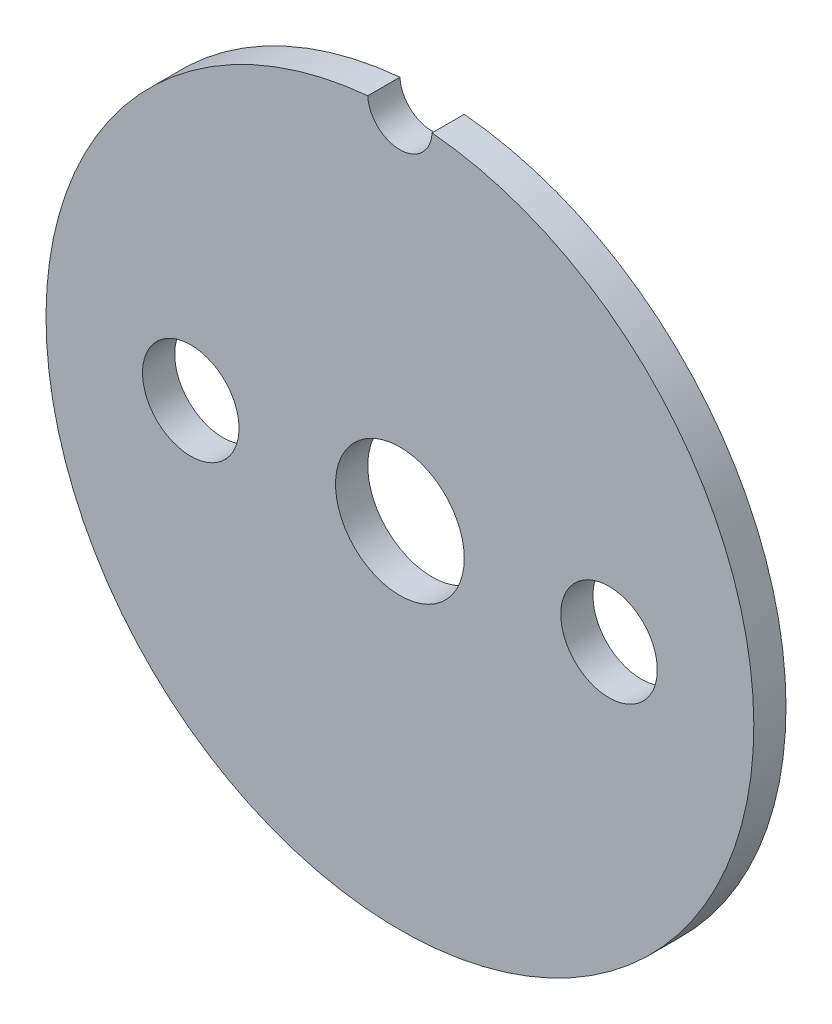
from build123d import *

# Parameters (mm, degrees)
SKETCH_1_R          = 11
SKETCH_1_R_2        = 1.5
SKETCH_1_R_3        = 2
EXTRUDE_1_DEPTH     = 1
SKETCH_2_R          = 1
CUT_EXTRUDE_1_DEPTH = 10


with BuildPart() as part:
    # 草图1 → 凸台-拉伸1 (new body)
    with BuildSketch(Plane.XY):
        with Locations((0.783567134, -3.891783567)):
            Circle(SKETCH_1_R)
        with Locations((-5.716432866, -3.891783567)):
            Circle(SKETCH_1_R_2, mode=Mode.SUBTRACT)
        with Locations(Location((7.283567134, -3.891783567, 0), (0, 0, 180))):
            Circle(SKETCH_1_R_2, mode=Mode.SUBTRACT)
        with Locations((0.783567134, -3.891783567)):
            Circle(SKETCH_1_R_3, mode=Mode.SUBTRACT)
    extrude(amount=EXTRUDE_1_DEPTH)

    # 草图2 → 切除-拉伸1 (cut)
    with BuildSketch(Plane.XY.offset(1)):
        with Locations((0.783567134, 7.108216433)):
            Circle(SKETCH_2_R)
    extrude(amount=-CUT_EXTRUDE_1_DEPTH, mode=Mode.SUBTRACT)


solid = part.part
